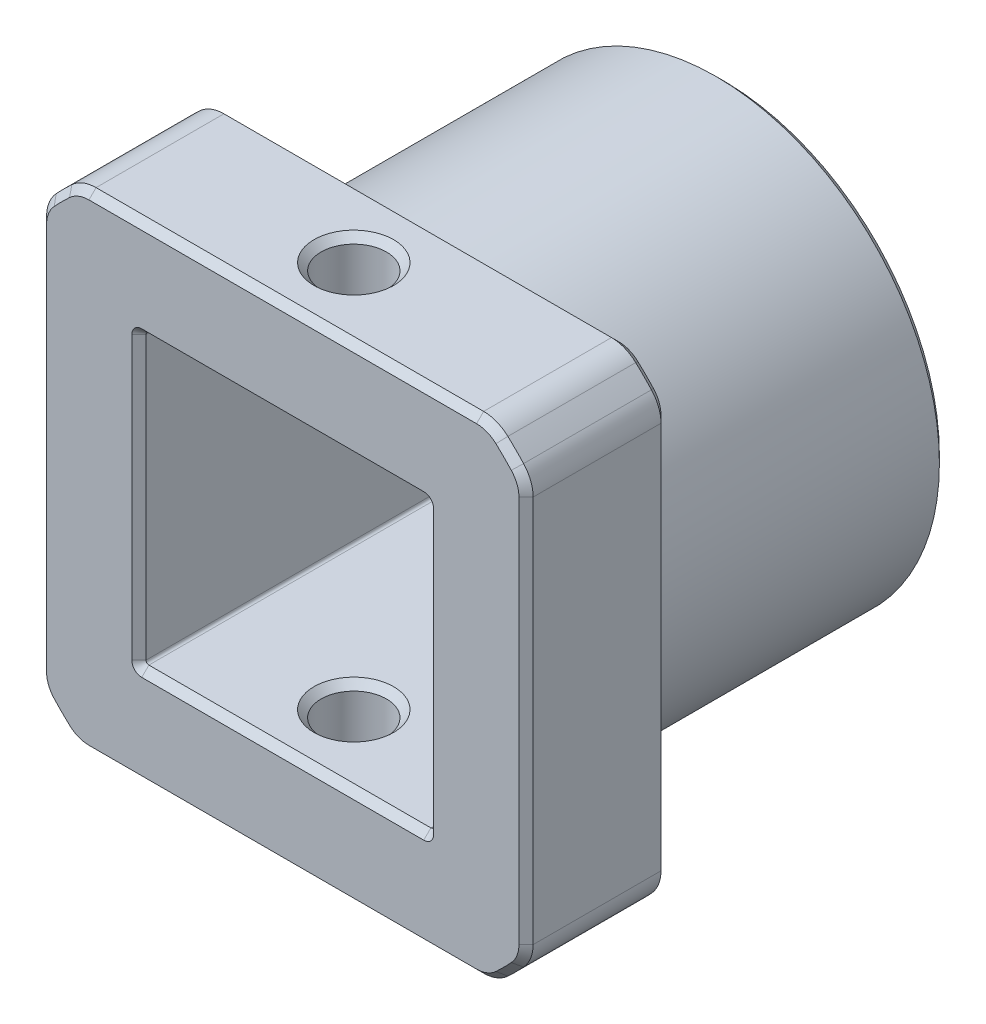
from build123d import *

# Parameters (mm, degrees)
SKIZZE1_R                       = 15.725
SKIZZE1_W                       = 20.25
SKIZZE1_H                       = 20.25
AUFSATZ_LINEAR_AUSTRAGEN1_DEPTH = 21
SKIZZE2_W                       = 20.25
SKIZZE2_H                       = 20.25
AUFSATZ_LINEAR_AUSTRAGEN2_DEPTH = 10
SKIZZE3_R                       = 2.3
SCHNITT_LINEAR_AUSTRAGEN1_DEPTH = 50.267921866
VERRUNDUNG1_R                   = 0.2
VERRUNDUNG2_R                   = 2.5
FASE1_SIZE                      = 0.5
FASE4_SIZE                      = 0.5


with BuildPart() as part:
    # Skizze1 → Aufsatz-Linear austragen1 (new body)
    with BuildSketch(Plane.XY):
        with Locations(Location((0, 0, 0), (0, 0, 180))):
            Circle(SKIZZE1_R)
        Rectangle(SKIZZE1_W, SKIZZE1_H, mode=Mode.SUBTRACT)
    extrude(amount=AUFSATZ_LINEAR_AUSTRAGEN1_DEPTH)

    # Skizze2 → Aufsatz-Linear austragen2 (add)
    with BuildSketch(Plane.XY.offset(21)):
        with BuildLine():
            Line((-14.593984206, 17.125), (14.593984206, 17.125))
            ThreePointArc((14.593984206, 17.125), (15.909902577, 15.909902577), (17.125, 14.593984206))
            Line((17.125, 14.593984206), (17.125, -14.593984206))
            ThreePointArc((17.125, -14.593984206), (15.909902577, -15.909902577), (14.593984206, -17.125))
            Line((14.593984206, -17.125), (-14.593984206, -17.125))
            ThreePointArc((-14.593984206, -17.125), (-15.909902577, -15.909902577), (-17.125, -14.593984206))
            Line((-17.125, -14.593984206), (-17.125, 14.593984206))
            ThreePointArc((-17.125, 14.593984206), (-15.909902577, 15.909902577), (-14.593984206, 17.125))
        make_face()
        Rectangle(SKIZZE2_W, SKIZZE2_H, mode=Mode.SUBTRACT)
    extrude(amount=AUFSATZ_LINEAR_AUSTRAGEN2_DEPTH)

    # Skizze3 → Schnitt-Linear austragen1 (cut, through all)
    with BuildSketch(Plane(origin=(0, 17.125, 0), x_dir=(1, 0, 0), z_dir=(0, 1, 0))):
        with Locations(Location((0, -26, 0), (0, 0, 270))):
            Circle(SKIZZE3_R)
    extrude(amount=-SCHNITT_LINEAR_AUSTRAGEN1_DEPTH, mode=Mode.SUBTRACT)

    # Verrundung1
    verrundung1_edges = [part.edges().sort_by_distance(p)[0] for p in [
        (10.125, -10.125, 15.5),
        (10.125, 10.125, 15.5),
        (-10.125, 10.125, 15.5),
        (-10.125, -10.125, 15.5),
    ]]
    fillet(verrundung1_edges, radius=VERRUNDUNG1_R)

    # Verrundung2
    verrundung2_edges = [part.edges().sort_by_distance(p)[0] for p in [
        (-14.593984206, 17.125, 26),
        (-17.125, 14.593984206, 26),
        (-17.125, -14.593984206, 26),
        (-14.593984206, -17.125, 26),
        (14.593984206, -17.125, 26),
        (17.125, -14.593984206, 26),
        (17.125, 14.593984206, 26),
        (14.593984206, 17.125, 26),
    ]]
    fillet(verrundung2_edges, radius=VERRUNDUNG2_R)

    # Fase1
    fase1_edges = [part.edges().sort_by_distance(p)[0] for p in [
        (0, 17.125, 31),
        (-14.558620883, 16.950974258, 31),
        (-16.950974258, 14.558620883, 31),
        (14.558620883, 16.950974258, 31),
        (16.950974258, 14.558620883, 31),
        (16.950974258, -14.558620883, 31),
        (14.558620883, -16.950974258, 31),
        (-14.558620883, -16.950974258, 31),
        (-16.950974258, -14.558620883, 31),
        (15.725, 0, 0),
        (0, -10.125, 23.7),
        (0, 10.125, 23.7),
        (0, -17.125, 23.7),
        (0, 17.125, 23.7),
        (0, -10.125, 0),
        (0, -10.125, 31),
        (10.125, 0, 0),
        (10.125, 0, 31),
        (-10.125, 0, 0),
        (-10.125, 0, 31),
        (0, 10.125, 0),
        (0, 10.125, 31),
        (10.066421356, -10.066421356, 0),
        (10.066421356, -10.066421356, 31),
        (-10.066421356, -10.066421356, 0),
        (-10.066421356, -10.066421356, 31),
        (-10.066421356, 10.066421356, 0),
        (-10.066421356, 10.066421356, 31),
        (10.066421356, 10.066421356, 0),
        (10.066421356, 10.066421356, 31),
        (-15.909902577, -15.909902577, 31),
        (-17.125, 0, 31),
        (-15.909902577, 15.909902577, 31),
        (0, -17.125, 31),
        (15.909902577, -15.909902577, 31),
        (17.125, 0, 31),
        (15.909902577, 15.909902577, 31),
    ]]
    chamfer(fase1_edges, length=FASE1_SIZE)

    # Fase4
    fase4_edges = [part.edges().sort_by_distance(p)[0] for p in [
        (-15.909902577, -15.909902577, 21),
        (-15.909902577, 15.909902577, 21),
        (0, 17.125, 21),
        (15.909902577, 15.909902577, 21),
        (17.125, 0, 21),
        (15.909902577, -15.909902577, 21),
        (0, -17.125, 21),
        (-17.125, 0, 21),
        (-14.558620883, 16.950974258, 21),
        (-16.950974258, 14.558620883, 21),
        (14.558620883, 16.950974258, 21),
        (16.950974258, 14.558620883, 21),
        (16.950974258, -14.558620883, 21),
        (14.558620883, -16.950974258, 21),
        (-14.558620883, -16.950974258, 21),
        (-16.950974258, -14.558620883, 21),
    ]]
    chamfer(fase4_edges, length=FASE4_SIZE)


solid = part.part
